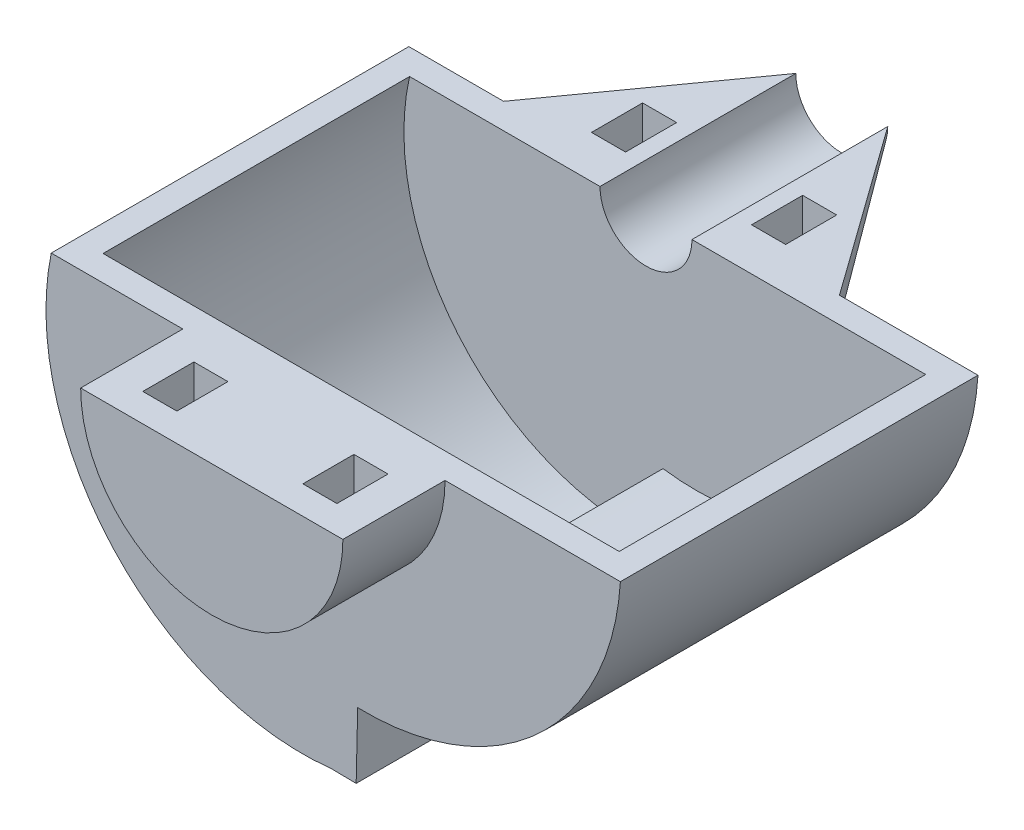
from build123d import *

# Parameters (mm, degrees)
SALIENTE_EXTRUIR1_DEPTH = 18
SALIENTE_EXTRUIR2_START = 1.5
CROQUIS2_R              = 2.7
SALIENTE_EXTRUIR2_DEPTH = 1.5
SALIENTE_EXTRUIR3_DEPTH = 1.5
CROQUIS6_W              = 5.4
CROQUIS6_H              = 1.181933233
SALIENTE_EXTRUIR7_DEPTH = 10
CROQUIS7_W              = 5.4
CROQUIS7_H              = 10
CORTAR_EXTRUIR2_DEPTH   = 16.5
CROQUIS9_W              = 52.468080771
CROQUIS9_H              = 55.683263094
CORTAR_EXTRUIR3_DEPTH   = 30
CROQUIS10_W             = 2
CROQUIS10_H             = 3
CROQUIS10_W_2           = 2.00103554
CORTAR_EXTRUIR4_DEPTH   = 10
CROQUIS11_W             = 3.003829207
CROQUIS11_H             = 8.377286569
CROQUIS11_W_2           = 3
CROQUIS11_H_2           = 6.580683582
CORTAR_EXTRUIR5_DEPTH   = 7.4


with BuildPart() as part:
    # Croquis1 → Saliente-Extruir1 (new body)
    with BuildSketch(Plane.XY):
        with BuildLine():
            Line((-54.535099114, 31.482780649), (-55.25791247, 32.775048384))
            Line((-55.25791247, 32.775048384), (-58.679569293, 30.903614553))
            ThreePointArc((-58.679569293, 30.903614553), (-72.555259572, 38.768368337), (-85.712228427, 29.752642999))
            Line((-85.712228427, 29.752642999), (-86.469958437, 28.480534403))
            Line((-86.469958437, 28.480534403), (-83.138420786, 26.453009587))
            ThreePointArc((-83.138420786, 26.453009587), (-83.011652218, 10.503932418), (-68.625320614, 3.617525822))
            Line((-68.625320614, 3.617525822), (-67.144777249, 3.597366682))
            Line((-67.144777249, 3.597366682), (-67.054658077, 7.49632533))
            ThreePointArc((-67.054658077, 7.49632533), (-53.305736365, 15.580648714), (-54.535099114, 31.482780649))
        make_face()
        with BuildLine():
            Line((-69.624216052, 5.117649823), (-68.624216052, 5.117649823))
            Line((-68.624216052, 5.117649823), (-68.624216052, 9.117649823))
            ThreePointArc((-68.624216052, 9.117649823), (-55.305921191, 15.218525867), (-55.334796889, 29.867649823))
            Line((-55.334796889, 29.867649823), (-55.834796889, 30.733675227))
            Line((-55.834796889, 30.733675227), (-59.298898504, 28.733675227))
            ThreePointArc((-59.298898504, 28.733675227), (-71.241559574, 37.21721889), (-83.913635214, 29.867649823))
            Line((-83.913635214, 29.867649823), (-84.413635214, 29.001624419))
            Line((-84.413635214, 29.001624419), (-80.949533599, 27.001624419))
            ThreePointArc((-80.949533599, 27.001624419), (-82.325167391, 12.417204713), (-69.624216052, 5.117649823))
        make_face(mode=Mode.SUBTRACT)
    extrude(amount=SALIENTE_EXTRUIR1_DEPTH)

    # Croquis2 → Saliente-Extruir2 (add)
    with BuildSketch(Plane(origin=(0, 0, 0), x_dir=(-1, 0, 0), z_dir=(0, 0, -1)).offset(SALIENTE_EXTRUIR2_START)):
        with BuildLine():
            Line((67.054658077, 7.49632533), (67.144777249, 3.597366682))
            Line((67.144777249, 3.597366682), (68.625320614, 3.617525822))
            ThreePointArc((68.625320614, 3.617525822), (83.011652218, 10.503932418), (83.138420786, 26.453009587))
            Line((83.138420786, 26.453009587), (86.469958437, 28.480534403))
            Line((86.469958437, 28.480534403), (85.712228427, 29.752642999))
            ThreePointArc((85.712228427, 29.752642999), (72.555259572, 38.768368337), (58.679569293, 30.903614553))
            Line((58.679569293, 30.903614553), (55.25791247, 32.775048384))
            Line((55.25791247, 32.775048384), (54.535099114, 31.482780649))
            ThreePointArc((54.535099114, 31.482780649), (53.305736365, 15.580648714), (67.054658077, 7.49632533))
        make_face()
        with Locations((69.624216052, 21.617649823)):
            Circle(CROQUIS2_R, mode=Mode.SUBTRACT)
    extrude(amount=-SALIENTE_EXTRUIR2_DEPTH)

    # Croquis3 → Saliente-Extruir3 (add)
    with BuildSketch(Plane.XY.offset(18)):
        with BuildLine():
            Line((-67.144777249, 3.597366682), (-67.054658077, 7.49632533))
            ThreePointArc((-67.054658077, 7.49632533), (-53.305736365, 15.580648714), (-54.535099114, 31.482780649))
            Line((-54.535099114, 31.482780649), (-55.25791247, 32.775048384))
            Line((-55.25791247, 32.775048384), (-58.679569293, 30.903614553))
            ThreePointArc((-58.679569293, 30.903614553), (-72.555259572, 38.768368337), (-85.712228427, 29.752642999))
            Line((-85.712228427, 29.752642999), (-86.469958437, 28.480534403))
            Line((-86.469958437, 28.480534403), (-83.138420786, 26.453009587))
            ThreePointArc((-83.138420786, 26.453009587), (-83.011652218, 10.503932418), (-68.625320614, 3.617525822))
            Line((-68.625320614, 3.617525822), (-67.144777249, 3.597366682))
        make_face()
    extrude(amount=SALIENTE_EXTRUIR3_DEPTH)

    # Croquis6 → Saliente-Extruir7 (add)
    with BuildSketch(Plane(origin=(0, 0, -1.5), x_dir=(-1, 0, 0), z_dir=(0, 0, -1))):
        with Locations((69.624216052, 21.026683207)):
            Rectangle(CROQUIS6_W, CROQUIS6_H)
    extrude(amount=SALIENTE_EXTRUIR7_DEPTH)

    # Croquis7 → Cortar-Extruir2 (cut)
    with BuildSketch(Plane(origin=(0, 21.617649823, 0), x_dir=(1, 0, 0), z_dir=(0, 1, 0))):
        with Locations((-69.624216052, 6.5)):
            Rectangle(CROQUIS7_W, CROQUIS7_H)
    extrude(amount=-CORTAR_EXTRUIR2_DEPTH, mode=Mode.SUBTRACT)

    # Croquis8 → Revolución1 (revolve)
    with BuildSketch(Plane(origin=(0, 21.617649823, 0), x_dir=(1, 0, 0), z_dir=(0, 1, 0)), mode=Mode.PRIVATE) as revoluci_n1_sk:
        Polygon((-72.324216052, 1.5), (-79.486781688, 1.5), (-72.324216052, 11.5), align=None)
        Polygon((-72.324216052, -19.5), (-69.624216052, -19.5), (-69.624216052, -25.5), (-72.324216052, -25.5), (-77.324216052, -25.5), (-77.324216052, -19.5), align=None)
    revolve(revoluci_n1_sk.sketch.rotate(Axis((-69.624216052, 21.617649823, 19.5), (0, 0, 1)), 180), axis=Axis((-69.624216052, 21.617649823, 19.5), (0, 0, 1)))

    # Croquis9 → Cortar-Extruir3 (cut)
    with BuildSketch(Plane(origin=(0, 21.617649823, 0), x_dir=(1, 0, 0), z_dir=(0, 1, 0))):
        with Locations((-61.70964897, -8.735329994)):
            Rectangle(CROQUIS9_W, CROQUIS9_H)
    extrude(amount=CORTAR_EXTRUIR3_DEPTH, mode=Mode.SUBTRACT)

    # Croquis10 → Cortar-Extruir4 (cut)
    with BuildSketch(Plane(origin=(0, 21.617649823, 0), x_dir=(1, 0, 0), z_dir=(0, 1, 0))):
        with Locations((-74.324216052, 4)):
            Rectangle(CROQUIS10_W, CROQUIS10_H)
        with Locations((-64.923698282, 4)):
            Rectangle(CROQUIS10_W_2, CROQUIS10_H)
        with Locations((-74.324216052, -22.35)):
            Rectangle(CROQUIS10_W, CROQUIS10_H)
        with Locations((-64.923698282, -22.35)):
            Rectangle(CROQUIS10_W_2, CROQUIS10_H)
    extrude(amount=-CORTAR_EXTRUIR4_DEPTH, mode=Mode.SUBTRACT)

    # Croquis11 → Cortar-Extruir5 (cut)
    with BuildSketch(Plane(origin=(-65.924216052, 0, 0), x_dir=(0, 0, -1), z_dir=(1, 0, 0))):
        with Locations((-22.348085397, 13.363371819)):
            Rectangle(CROQUIS11_W, CROQUIS11_H)
        with Locations((4, 12.973671933)):
            Rectangle(CROQUIS11_W_2, CROQUIS11_H_2)
    extrude(amount=-CORTAR_EXTRUIR5_DEPTH, mode=Mode.SUBTRACT)


solid = part.part
